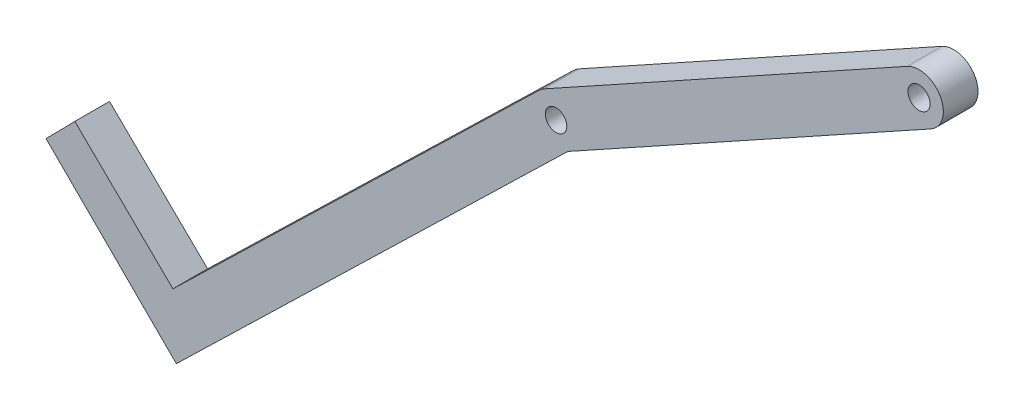
from build123d import *

# Parameters (mm, degrees)
SKETCH1_R           = 3.5
SKETCH1_R_2         = 1.55
SKETCH1_R_3         = 1.6
BOSS_EXTRUDE1_DEPTH = 5


with BuildPart() as part:
    # Sketch1 → Boss-Extrude1 (new body)
    # profile 1 of 4: a face of its own
    with BuildSketch(Plane.XY):
        with BuildLine():
            ThreePointArc((-50.379412597, -32.059346711), (-54.886807697, -31.081444916), (-54.511132434, -26.484514353))
            Line((-54.511132434, -26.484514353), (-107.325001283, -77.686959994))
            Line((-107.325001283, -77.686959994), (-121.473901164, -63.850866788))
            Line((-121.473901164, -63.850866788), (-123.810410836, -66.240200318))
            Line((-123.810410836, -66.240200318), (-125.631536255, -68.068297032))
            Line((-125.631536255, -68.068297032), (-106.835385186, -86.792770537))
            Line((-106.835385186, -86.792770537), (-50.379412597, -32.059346711))
        make_face()
    # profile 2 of 4: a face of its own
    with BuildSketch(Plane.XY):
        with BuildLine():
            Line((-1.415959287, 3.054745501), (-53.770371078, -25.935507998))
            ThreePointArc((-53.770371078, -25.935507998), (-50.297840536, -25.982118304), (-48.574891838, -28.997427354))
            ThreePointArc((-48.574891838, -28.997427354), (-49.059582787, -30.774478656), (-50.379412597, -32.059346711))
            Line((-50.379412597, -32.059346711), (1.974999193, -3.069093212))
            ThreePointArc((1.974999193, -3.069093212), (-2.782399403, -1.702653096), (-1.415959287, 3.054745501))
        make_face()
    # profile 3 of 4: a face of its own
    with BuildSketch(Plane.XY):
        with Locations((-52.074891838, -28.997427354)):
            Circle(SKETCH1_R)
        with Locations((-52.074891838, -28.997427354)):
            Circle(SKETCH1_R_2, mode=Mode.SUBTRACT)
    # profile 4 of 4: a face of its own
    with BuildSketch(Plane.XY):
        with Locations((0.279519953, -0.007173855)):
            Circle(SKETCH1_R)
        with Locations((0.279519953, -0.007173855)):
            Circle(SKETCH1_R_3, mode=Mode.SUBTRACT)
    extrude(amount=BOSS_EXTRUDE1_DEPTH)


solid = part.part
